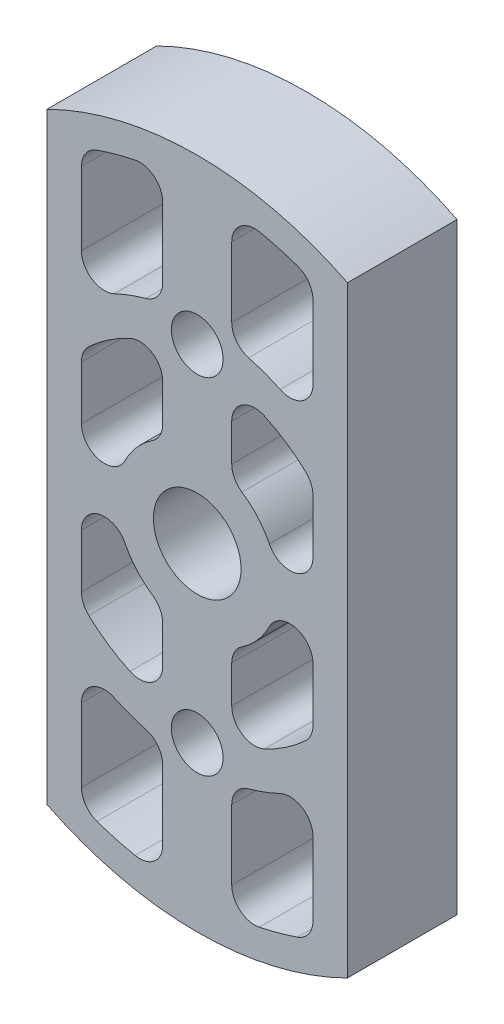
from build123d import *

# Parameters (mm, degrees)
SKETCH1_R          = 29.25
EXTRUDE_3_8_DEPTH  = 9.525
CUT_EXTRUDE1_DEPTH = 9.525
SKETCH3_R          = 2.25
M4_THROUGH_DEPTH   = 9.525
SKETCH4_R          = 3.81
F_3_8_DRILL_DEPTH  = 9.525
SKETCH6_W          = 18.02935576
SKETCH6_H          = 57.579918791
CUT_EXTRUDE2_DEPTH = 9.525


with BuildPart() as part:
    # Sketch1 → 3/8 (new body)
    with BuildSketch(Plane.XY):
        with Locations(Location((0, 0, 0), (0, 0, 180))):
            Circle(SKETCH1_R)
    extrude(amount=EXTRUDE_3_8_DEPTH)

    # Sketch2 → Cut-Extrude1 (cut)
    with BuildSketch(Plane.XY.offset(9.525)):
        with BuildLine():
            Line((-3, 24.219267124), (-3, 18.154700472))
            ThreePointArc((-3, 18.154700472), (-3.409072822, 16.942697702), (-4.468950714, 16.226492325))
            ThreePointArc((-4.468950714, 16.226492325), (-5.859541661, 15.777716729), (-7.205966503, 15.210017108))
            ThreePointArc((-7.205966503, 15.210017108), (-9.131700947, 15.327380042), (-10.062257748, 17.017436623))
            Line((-10.062257748, 17.017436623), (-10.062257748, 23.378898605))
            ThreePointArc((-10.062257748, 23.378898605), (-9.690760884, 24.539922954), (-8.714280211, 25.269630397))
            ThreePointArc((-8.714280211, 25.269630397), (-7.073918129, 25.776977757), (-5.404367165, 26.177962402))
            ThreePointArc((-5.404367165, 26.177962402), (-3.736816389, 25.769869318), (-3, 24.219267124))
        make_face()
        with BuildLine():
            Line((-3, 10.72213294), (-3, 7.483314774))
            ThreePointArc((-3, 7.483314774), (-3.236165793, 6.540505732), (-3.888888889, 5.820355935))
            ThreePointArc((-3.888888889, 5.820355935), (-5.257283867, 4.621792546), (-6.270644915, 3.111111111))
            ThreePointArc((-6.270644915, 3.111111111), (-8.518752181, 2.052793582), (-10.062257748, 4))
            Line((-10.062257748, 4), (-10.062257748, 8.658183111))
            ThreePointArc((-10.062257748, 8.658183111), (-9.896091132, 9.45634044), (-9.425202627, 10.121870666))
            ThreePointArc((-9.425202627, 10.121870666), (-7.729958395, 11.468847089), (-5.845262531, 12.534736386))
            ThreePointArc((-5.845262531, 12.534736386), (-3.925412885, 12.408923541), (-3, 10.72213294))
        make_face()
        with BuildLine():
            Line((3, 10.72213294), (3, 7.483314774))
            ThreePointArc((3, 7.483314774), (3.236165793, 6.540505732), (3.888888889, 5.820355935))
            ThreePointArc((3.888888889, 5.820355935), (5.257283867, 4.621792546), (6.270644915, 3.111111111))
            ThreePointArc((6.270644915, 3.111111111), (8.518752181, 2.052793582), (10.062257748, 4))
            Line((10.062257748, 4), (10.062257748, 8.658183111))
            ThreePointArc((10.062257748, 8.658183111), (9.896091132, 9.45634044), (9.425202627, 10.121870666))
            ThreePointArc((9.425202627, 10.121870666), (7.729958395, 11.468847089), (5.845262531, 12.534736386))
            ThreePointArc((5.845262531, 12.534736386), (3.925412885, 12.408923541), (3, 10.72213294))
        make_face()
        with BuildLine():
            Line((3, 24.219267124), (3, 18.154700472))
            ThreePointArc((3, 18.154700472), (3.409072822, 16.942697702), (4.468950714, 16.226492325))
            ThreePointArc((4.468950714, 16.226492325), (5.859541661, 15.777716729), (7.205966503, 15.210017108))
            ThreePointArc((7.205966503, 15.210017108), (9.131700947, 15.327380042), (10.062257748, 17.017436623))
            Line((10.062257748, 17.017436623), (10.062257748, 23.378898605))
            ThreePointArc((10.062257748, 23.378898605), (9.690760884, 24.539922954), (8.714280211, 25.269630397))
            ThreePointArc((8.714280211, 25.269630397), (7.073918129, 25.776977757), (5.404367165, 26.177962402))
            ThreePointArc((5.404367165, 26.177962402), (3.736816389, 25.769869318), (3, 24.219267124))
        make_face()
        with BuildLine():
            Line((-3, -10.72213294), (-3, -7.483314774))
            ThreePointArc((-3, -7.483314774), (-3.236165793, -6.540505732), (-3.888888889, -5.820355935))
            ThreePointArc((-3.888888889, -5.820355935), (-5.257283867, -4.621792546), (-6.270644915, -3.111111111))
            ThreePointArc((-6.270644915, -3.111111111), (-8.518752181, -2.052793582), (-10.062257748, -4))
            Line((-10.062257748, -4), (-10.062257748, -8.658183111))
            ThreePointArc((-10.062257748, -8.658183111), (-9.896091132, -9.45634044), (-9.425202627, -10.121870666))
            ThreePointArc((-9.425202627, -10.121870666), (-7.729958395, -11.468847089), (-5.845262531, -12.534736386))
            ThreePointArc((-5.845262531, -12.534736386), (-3.925412885, -12.408923541), (-3, -10.72213294))
        make_face()
        with BuildLine():
            Line((3, -10.72213294), (3, -7.483314774))
            ThreePointArc((3, -7.483314774), (3.236165793, -6.540505732), (3.888888889, -5.820355935))
            ThreePointArc((3.888888889, -5.820355935), (5.257283867, -4.621792546), (6.270644915, -3.111111111))
            ThreePointArc((6.270644915, -3.111111111), (8.518752181, -2.052793582), (10.062257748, -4))
            Line((10.062257748, -4), (10.062257748, -8.658183111))
            ThreePointArc((10.062257748, -8.658183111), (9.896091132, -9.45634044), (9.425202627, -10.121870666))
            ThreePointArc((9.425202627, -10.121870666), (7.729958395, -11.468847089), (5.845262531, -12.534736386))
            ThreePointArc((5.845262531, -12.534736386), (3.925412885, -12.408923541), (3, -10.72213294))
        make_face()
        with BuildLine():
            Line((3, -24.219267124), (3, -18.154700472))
            ThreePointArc((3, -18.154700472), (3.409072822, -16.942697702), (4.468950714, -16.226492325))
            ThreePointArc((4.468950714, -16.226492325), (5.859541661, -15.777716729), (7.205966503, -15.210017108))
            ThreePointArc((7.205966503, -15.210017108), (9.131700947, -15.327380042), (10.062257748, -17.017436623))
            Line((10.062257748, -17.017436623), (10.062257748, -23.378898605))
            ThreePointArc((10.062257748, -23.378898605), (9.690760884, -24.539922954), (8.714280211, -25.269630397))
            ThreePointArc((8.714280211, -25.269630397), (7.073918129, -25.776977757), (5.404367165, -26.177962402))
            ThreePointArc((5.404367165, -26.177962402), (3.736816389, -25.769869318), (3, -24.219267124))
        make_face()
        with BuildLine():
            Line((-3, -24.219267124), (-3, -18.154700472))
            ThreePointArc((-3, -18.154700472), (-3.409072822, -16.942697702), (-4.468950714, -16.226492325))
            ThreePointArc((-4.468950714, -16.226492325), (-5.859541661, -15.777716729), (-7.205966503, -15.210017108))
            ThreePointArc((-7.205966503, -15.210017108), (-9.131700947, -15.327380042), (-10.062257748, -17.017436623))
            Line((-10.062257748, -17.017436623), (-10.062257748, -23.378898605))
            ThreePointArc((-10.062257748, -23.378898605), (-9.690760884, -24.539922954), (-8.714280211, -25.269630397))
            ThreePointArc((-8.714280211, -25.269630397), (-7.073918129, -25.776977757), (-5.404367165, -26.177962402))
            ThreePointArc((-5.404367165, -26.177962402), (-3.736816389, -25.769869318), (-3, -24.219267124))
        make_face()
    extrude(amount=-CUT_EXTRUDE1_DEPTH, mode=Mode.SUBTRACT)

    # Sketch3 → M4_through (cut)
    with BuildSketch(Plane.XY.offset(9.525)):
        with Locations((0, 15)):
            Circle(SKETCH3_R)
        with Locations((0, -15)):
            Circle(SKETCH3_R)
    extrude(amount=-M4_THROUGH_DEPTH, mode=Mode.SUBTRACT)

    # Sketch4 → 3/8_DRILL (cut)
    with BuildSketch(Plane.XY.offset(9.525)):
        Circle(SKETCH4_R)
    extrude(amount=-F_3_8_DRILL_DEPTH, mode=Mode.SUBTRACT)

    # Sketch6 → Cut-Extrude2 (cut)
    with BuildSketch(Plane.XY.offset(9.525)):
        with Locations((-22.076935628, -1.336167669)):
            Rectangle(SKETCH6_W, SKETCH6_H)
        with Locations((22.076935628, -1.336167669)):
            Rectangle(SKETCH6_W, SKETCH6_H)
    extrude(amount=-CUT_EXTRUDE2_DEPTH, mode=Mode.SUBTRACT)


solid = part.part
